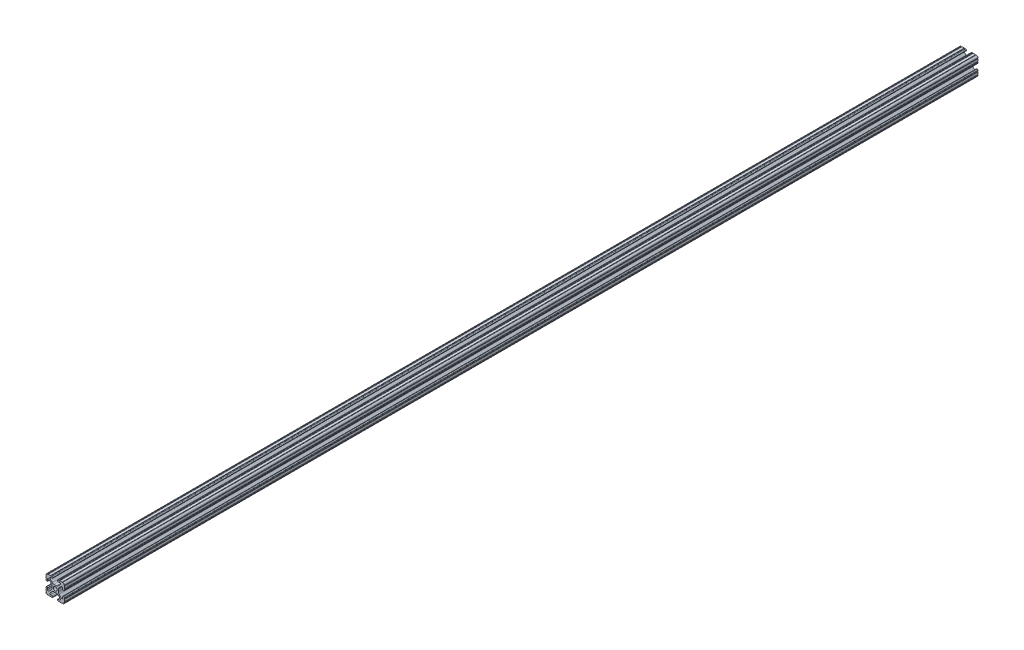
from build123d import *

# Parameters (mm, degrees)
SKETCH1_R      = 2.6035
EXTRUDE1_DEPTH = 1270


with BuildPart() as part:
    # Sketch1 → Extrude1 (new body)
    with BuildSketch(Plane.XY):
        with BuildLine():
            Line((-7.207036008, 8.724370562), (-3.898272566, 5.423169045))
            ThreePointArc((-3.898272566, 5.423169045), (-2.869120213, 4.736787962), (-1.655778399, 4.4958))
            Line((-1.655778399, 4.4958), (1.655778399, 4.4958))
            ThreePointArc((1.655778399, 4.4958), (2.869120213, 4.736787962), (3.898272566, 5.423169045))
            Line((3.898272566, 5.423169045), (7.207036008, 8.724370562))
            ThreePointArc((7.207036008, 8.724370562), (7.432222385, 9.85140422), (6.476788598, 10.4902))
            Line((6.476788598, 10.4902), (4.287512407, 10.4902))
            ThreePointArc((4.287512407, 10.4902), (3.54574862, 10.79744862), (3.2385, 11.539212407))
            Line((3.2385, 11.539212407), (3.2385, 11.650987593))
            ThreePointArc((3.2385, 11.650987593), (3.54574862, 12.39275138), (4.287512407, 12.7))
            Line((4.287512407, 12.7), (5.317126718, 12.7))
            ThreePointArc((5.317126718, 12.7), (5.825126718, 12.192), (6.333126718, 12.7))
            Line((6.333126718, 12.7), (9.550443118, 12.7))
            ThreePointArc((9.550443118, 12.7), (10.058366869, 12.192000006), (10.566443095, 12.699847501))
            ThreePointArc((10.566443095, 12.699847501), (12.082537762, 12.08250727), (12.699846982, 10.566399977))
            ThreePointArc((12.699846982, 10.566399977), (12.192000006, 10.058323491), (12.7, 9.5504))
            Line((12.7, 9.5504), (12.7, 6.3330836))
            ThreePointArc((12.7, 6.3330836), (12.192, 5.8250836), (12.7, 5.3170836))
            Line((12.7, 5.3170836), (12.7, 4.287469289))
            ThreePointArc((12.7, 4.287469289), (12.39275138, 3.545705502), (11.650987593, 3.238456882))
            Line((11.650987593, 3.238456882), (11.539212407, 3.238456882))
            ThreePointArc((11.539212407, 3.238456882), (10.79744862, 3.545705502), (10.4902, 4.287469289))
            Line((10.4902, 4.287469289), (10.4902, 6.402089023))
            ThreePointArc((10.4902, 6.402089023), (9.856505071, 7.351067942), (8.737131347, 7.129408934))
            Line((8.737131347, 7.129408934), (5.441005833, 3.840816462))
            ThreePointArc((5.441005833, 3.840816462), (4.750877967, 2.809883091), (4.5085, 1.593185507))
            Line((4.5085, 1.593185507), (4.5085, -1.593185507))
            ThreePointArc((4.5085, -1.593185507), (4.750877967, -2.809883091), (5.441005833, -3.840816462))
            Line((5.441005833, -3.840816462), (8.737131347, -7.129408934))
            ThreePointArc((8.737131347, -7.129408934), (9.856505071, -7.351067942), (10.4902, -6.402089023))
            Line((10.4902, -6.402089023), (10.4902, -4.287469289))
            ThreePointArc((10.4902, -4.287469289), (10.79744862, -3.545705502), (11.539212407, -3.238456882))
            Line((11.539212407, -3.238456882), (11.650987593, -3.238456882))
            ThreePointArc((11.650987593, -3.238456882), (12.39275138, -3.545705502), (12.7, -4.287469289))
            Line((12.7, -4.287469289), (12.7, -5.3170836))
            ThreePointArc((12.7, -5.3170836), (12.192, -5.8250836), (12.7, -6.3330836))
            Line((12.7, -6.3330836), (12.7, -9.5504))
            ThreePointArc((12.7, -9.5504), (12.192000006, -10.058323491), (12.699846982, -10.566399977))
            ThreePointArc((12.699846982, -10.566399977), (12.082537762, -12.08250727), (10.566443095, -12.699847501))
            ThreePointArc((10.566443095, -12.699847501), (10.058366869, -12.192000006), (9.550443118, -12.7))
            Line((9.550443118, -12.7), (6.333126718, -12.7))
            ThreePointArc((6.333126718, -12.7), (5.825126718, -12.192), (5.317126718, -12.7))
            Line((5.317126718, -12.7), (4.287512407, -12.7))
            ThreePointArc((4.287512407, -12.7), (3.54574862, -12.39275138), (3.2385, -11.650987593))
            Line((3.2385, -11.650987593), (3.2385, -11.539212407))
            ThreePointArc((3.2385, -11.539212407), (3.54574862, -10.79744862), (4.287512407, -10.4902))
            Line((4.287512407, -10.4902), (6.416408329, -10.4902))
            ThreePointArc((6.416408329, -10.4902), (7.41473083, -9.822813117), (7.179650497, -8.645192506))
            Line((7.179650497, -8.645192506), (3.952270251, -5.423690499))
            ThreePointArc((3.952270251, -5.423690499), (2.922936451, -4.736929036), (1.709253557, -4.4958))
            Line((1.709253557, -4.4958), (-1.709253557, -4.4958))
            ThreePointArc((-1.709253557, -4.4958), (-2.922936451, -4.736929036), (-3.952270251, -5.423690499))
            Line((-3.952270251, -5.423690499), (-7.179650497, -8.645192506))
            ThreePointArc((-7.179650497, -8.645192506), (-7.41473083, -9.822813117), (-6.416408329, -10.4902))
            Line((-6.416408329, -10.4902), (-4.287512407, -10.4902))
            ThreePointArc((-4.287512407, -10.4902), (-3.54574862, -10.79744862), (-3.2385, -11.539212407))
            Line((-3.2385, -11.539212407), (-3.2385, -11.650987593))
            ThreePointArc((-3.2385, -11.650987593), (-3.54574862, -12.39275138), (-4.287512407, -12.7))
            Line((-4.287512407, -12.7), (-5.317126718, -12.7))
            ThreePointArc((-5.317126718, -12.7), (-5.825126718, -12.192), (-6.333126718, -12.7))
            Line((-6.333126718, -12.7), (-9.550443118, -12.7))
            ThreePointArc((-9.550443118, -12.7), (-10.058366869, -12.192000006), (-10.566443095, -12.699847501))
            ThreePointArc((-10.566443095, -12.699847501), (-12.082537762, -12.08250727), (-12.699846982, -10.566399977))
            ThreePointArc((-12.699846982, -10.566399977), (-12.192000006, -10.058323491), (-12.7, -9.5504))
            Line((-12.7, -9.5504), (-12.7, -6.3330836))
            ThreePointArc((-12.7, -6.3330836), (-12.192, -5.8250836), (-12.7, -5.3170836))
            Line((-12.7, -5.3170836), (-12.7, -4.287469289))
            ThreePointArc((-12.7, -4.287469289), (-12.39275138, -3.545705502), (-11.650987593, -3.238456882))
            Line((-11.650987593, -3.238456882), (-11.539212407, -3.238456882))
            ThreePointArc((-11.539212407, -3.238456882), (-10.79744862, -3.545705502), (-10.4902, -4.287469289))
            Line((-10.4902, -4.287469289), (-10.4902, -6.402089023))
            ThreePointArc((-10.4902, -6.402089023), (-9.856505071, -7.351067942), (-8.737131347, -7.129408934))
            Line((-8.737131347, -7.129408934), (-5.441005833, -3.840816462))
            ThreePointArc((-5.441005833, -3.840816462), (-4.750877967, -2.809883091), (-4.5085, -1.593185507))
            Line((-4.5085, -1.593185507), (-4.5085, 1.593185507))
            ThreePointArc((-4.5085, 1.593185507), (-4.750877967, 2.809883091), (-5.441005833, 3.840816462))
            Line((-5.441005833, 3.840816462), (-8.737131347, 7.129408934))
            ThreePointArc((-8.737131347, 7.129408934), (-9.856505071, 7.351067942), (-10.4902, 6.402089023))
            Line((-10.4902, 6.402089023), (-10.4902, 4.287469289))
            ThreePointArc((-10.4902, 4.287469289), (-10.79744862, 3.545705502), (-11.539212407, 3.238456882))
            Line((-11.539212407, 3.238456882), (-11.650987593, 3.238456882))
            ThreePointArc((-11.650987593, 3.238456882), (-12.39275138, 3.545705502), (-12.7, 4.287469289))
            Line((-12.7, 4.287469289), (-12.7, 5.3170836))
            ThreePointArc((-12.7, 5.3170836), (-12.192, 5.8250836), (-12.7, 6.3330836))
            Line((-12.7, 6.3330836), (-12.7, 9.5504))
            ThreePointArc((-12.7, 9.5504), (-12.192000006, 10.058323491), (-12.699846982, 10.566399977))
            ThreePointArc((-12.699846982, 10.566399977), (-12.082537762, 12.08250727), (-10.566443095, 12.699847501))
            ThreePointArc((-10.566443095, 12.699847501), (-10.058366869, 12.192000006), (-9.550443118, 12.7))
            Line((-9.550443118, 12.7), (-6.333126718, 12.7))
            ThreePointArc((-6.333126718, 12.7), (-5.825126718, 12.192), (-5.317126718, 12.7))
            Line((-5.317126718, 12.7), (-4.287512407, 12.7))
            ThreePointArc((-4.287512407, 12.7), (-3.54574862, 12.39275138), (-3.2385, 11.650987593))
            Line((-3.2385, 11.650987593), (-3.2385, 11.539212407))
            ThreePointArc((-3.2385, 11.539212407), (-3.54574862, 10.79744862), (-4.287512407, 10.4902))
            Line((-4.287512407, 10.4902), (-6.476788598, 10.4902))
            ThreePointArc((-6.476788598, 10.4902), (-7.432222385, 9.85140422), (-7.207036008, 8.724370562))
        make_face()
        Circle(SKETCH1_R, mode=Mode.SUBTRACT)
    extrude(amount=-EXTRUDE1_DEPTH)


solid = part.part
